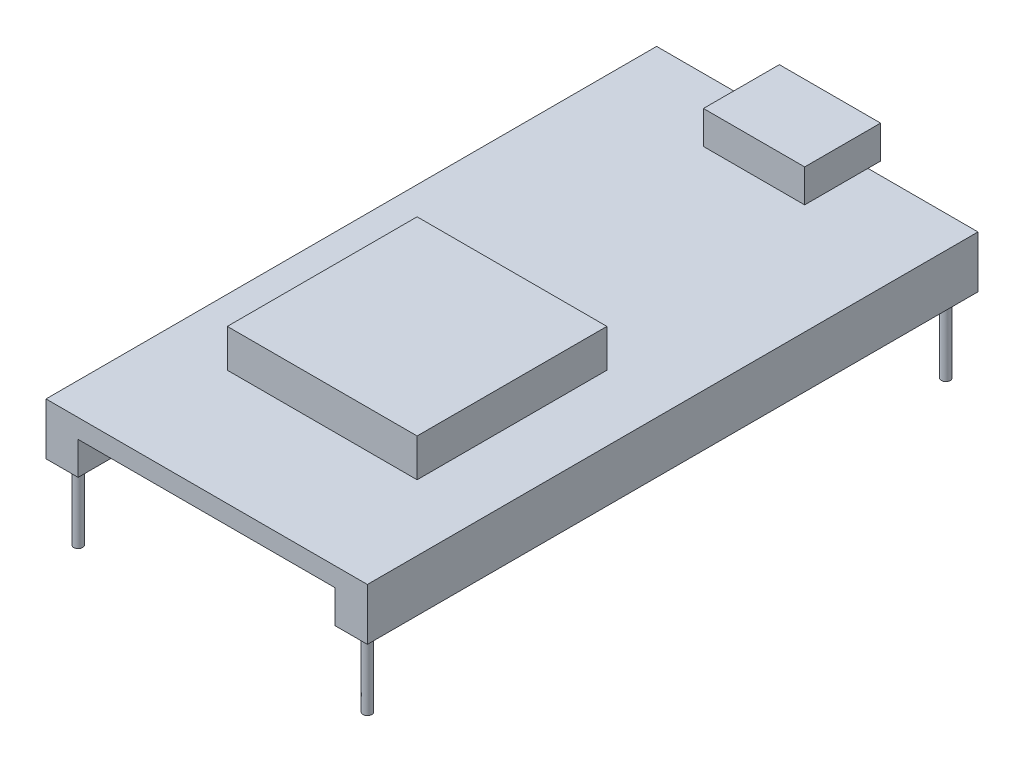
from build123d import *

# Parameters (mm, degrees)
SKETCH1_W           = 25.4
SKETCH1_H           = 48.26
BOSS_EXTRUDE1_DEPTH = 1.5
SKETCH2_W           = 15
SKETCH2_H           = 15
BOSS_EXTRUDE2_DEPTH = 3
SKETCH3_W           = 8
SKETCH3_H           = 6
BOSS_EXTRUDE3_DEPTH = 2.6
SKETCH4_W           = 2.54
SKETCH4_H           = 48.26
BOSS_EXTRUDE4_DEPTH = 2.6
SKETCH5_R           = 0.35
BOSS_EXTRUDE5_DEPTH = 5.9


with BuildPart() as part:
    # Sketch1 → Boss-Extrude1 (new body)
    with BuildSketch(Plane(origin=(0, 0, 0), x_dir=(1, 0, 0), z_dir=(0, 1, 0))):
        Rectangle(SKETCH1_W, SKETCH1_H)
    extrude(amount=BOSS_EXTRUDE1_DEPTH)

    # Sketch2 → Boss-Extrude2 (add)
    with BuildSketch(Plane(origin=(0, 1.5, 0), x_dir=(1, 0, 0), z_dir=(0, 1, 0))):
        with Locations((0, -7.5)):
            Rectangle(SKETCH2_W, SKETCH2_H)
    extrude(amount=BOSS_EXTRUDE2_DEPTH)

    # Sketch3 → Boss-Extrude3 (add)
    with BuildSketch(Plane(origin=(0, 1.5, 0), x_dir=(1, 0, 0), z_dir=(0, 1, 0))):
        with Locations((0, 22.13)):
            Rectangle(SKETCH3_W, SKETCH3_H)
    extrude(amount=BOSS_EXTRUDE3_DEPTH)

    # Sketch4 → Boss-Extrude4 (add)
    with BuildSketch(Plane.XZ):
        with Locations((-11.43, 0)):
            Rectangle(SKETCH4_W, SKETCH4_H)
        with Locations((11.43, 0)):
            Rectangle(SKETCH4_W, SKETCH4_H)
    extrude(amount=BOSS_EXTRUDE4_DEPTH)

    # Sketch5 → Boss-Extrude5 (add)
    with BuildSketch(Plane.XZ.offset(2.6)):
        with Locations(Location((11.43, -22.86, 0), (0, 0, 90))):
            Circle(SKETCH5_R)
        with Locations(Location((-11.43, -22.86, 0), (0, 0, 90))):
            Circle(SKETCH5_R)
        with Locations(Location((-11.43, 22.86, 0), (0, 0, 90))):
            Circle(SKETCH5_R)
        with Locations(Location((11.43, 22.86, 0), (0, 0, 90))):
            Circle(SKETCH5_R)
    extrude(amount=BOSS_EXTRUDE5_DEPTH)


solid = part.part
